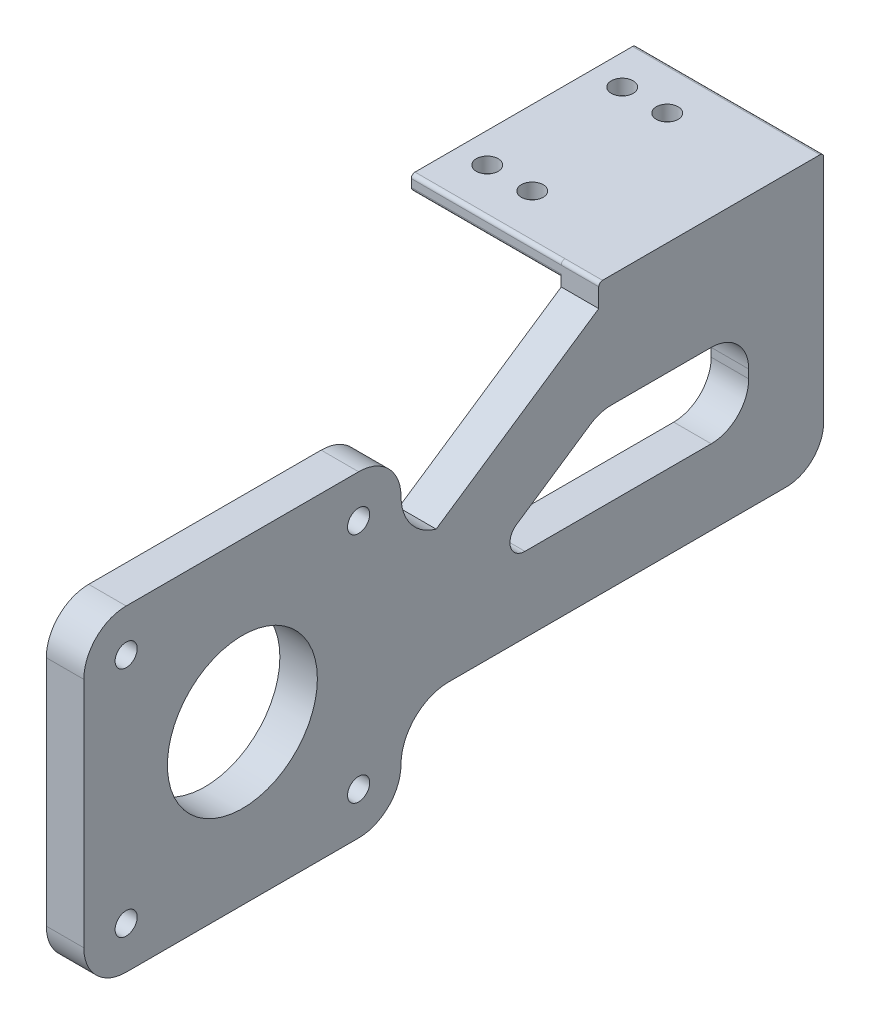
from build123d import *

# Parameters (mm, degrees)
SKETCH_1_R          = 10
SKETCH_1_R_2        = 1.475
EXTRUDE_1_DEPTH     = 5
FILLET_1_R          = 5
FILLET_2_R          = 5
FILLET_3_R          = 5
FILLET_4_R          = 5
FILLET_5_R          = 2
SKETCH_4_W          = 30
SKETCH_4_H          = 2.02
EXTRUDE_2_DEPTH     = 20
FILLET_11_R         = 0.5
FILLET_12_R         = 0.5
RIB_5_REACH         = 106.233
SKETCH_5_WALL_W     = 231.251388166
SKETCH_5_WALL_H     = 30
SKETCH_12_W         = 11
SKETCH_12_H         = 10.392304845
CUT_EXTRUDE_1_DEPTH = 20
FILLET_14_R         = 0.5
FILLET_15_R         = 0.5
SKETCH_14_R         = 1.46
CUT_EXTRUDE_2_DEPTH = 44


with BuildPart() as part:
    # 草图1 → 凸台-拉伸1 (new body)
    with BuildSketch(Plane(origin=(0, 0, 0), x_dir=(0, 0, -1), z_dir=(1, 0, 0))):
        with BuildLine():
            ThreePointArc((77.019141235, 27), (77.372694625, 26.853553391), (77.519141235, 26.5))
            Line((77.519141235, 26.5), (77.519141235, -9.130858765))
            Line((77.519141235, -9.130858765), (47.519141235, -9.130858765))
            Line((47.519141235, -9.130858765), (27.519141235, -9.130858765))
            ThreePointArc((27.519141235, -9.130858765), (23.015478277, -10.996337043), (21.15, -15.5))
            ThreePointArc((21.15, -15.5), (19.495153314, -19.495153314), (15.5, -21.15))
            Line((15.5, -21.15), (-15.5, -21.15))
            ThreePointArc((-15.5, -21.15), (-19.495153314, -19.495153314), (-21.15, -15.5))
            Line((-21.15, -15.5), (-21.15, 15.5))
            ThreePointArc((-21.15, 15.5), (-19.495153314, 19.495153314), (-15.5, 21.15))
            Line((-15.5, 21.15), (15.5, 21.15))
            ThreePointArc((15.5, 21.15), (19.495153314, 19.495153314), (21.15, 15.5))
            ThreePointArc((21.15, 15.5), (22.456034545, 11.635946336), (25.838516133, 9.356592205))
            Line((25.838516133, 9.356592205), (47.519141235, 23.98))
            Line((47.519141235, 23.98), (47.519141235, 26.5))
            ThreePointArc((47.519141235, 26.5), (47.665587844, 26.853553391), (48.019141235, 27))
            Line((48.019141235, 27), (77.019141235, 27))
        make_face()
        Circle(SKETCH_1_R, mode=Mode.SUBTRACT)
        with Locations((-15.5, -15.5)):
            Circle(SKETCH_1_R_2, mode=Mode.SUBTRACT)
        with Locations((15.5, -15.5)):
            Circle(SKETCH_1_R_2, mode=Mode.SUBTRACT)
        with Locations((15.5, 15.5)):
            Circle(SKETCH_1_R_2, mode=Mode.SUBTRACT)
        with Locations((-15.5, 15.5)):
            Circle(SKETCH_1_R_2, mode=Mode.SUBTRACT)
        Polygon((53.519141235, 0.869141235), (31.13826194, 0.869141235), (47.640843236, 12), (67.519141235, 12), (67.519141235, 0.869141235), (59.519141235, 0.869141235), align=None, mode=Mode.SUBTRACT)
    extrude(amount=EXTRUDE_1_DEPTH)

    # 圆角1
    fillet_1_edges = [part.edges().sort_by_distance(p)[0] for p in [
        (2.5, -9.130858765, -77.519141235),
    ]]
    fillet(fillet_1_edges, radius=FILLET_1_R)

    # 圆角2
    fillet_2_edges = [part.edges().sort_by_distance(p)[0] for p in [
        (2.5, 12, -67.519141235),
    ]]
    fillet(fillet_2_edges, radius=FILLET_2_R)

    # 圆角3
    fillet_3_edges = [part.edges().sort_by_distance(p)[0] for p in [
        (2.5, 12, -47.640843236),
    ]]
    fillet(fillet_3_edges, radius=FILLET_3_R)

    # 圆角4
    fillet_4_edges = [part.edges().sort_by_distance(p)[0] for p in [
        (2.5, 0.869141235, -67.519141235),
    ]]
    fillet(fillet_4_edges, radius=FILLET_4_R)

    # 圆角5
    fillet_5_edges = [part.edges().sort_by_distance(p)[0] for p in [
        (2.5, 0.869141235, -31.13826194),
    ]]
    fillet(fillet_5_edges, radius=FILLET_5_R)

    # 草图4 → 凸台-拉伸2 (add)
    with BuildSketch(Plane(origin=(0, 0, 0), x_dir=(0, 0, -1), z_dir=(1, 0, 0))):
        with Locations((62.519141235, 25.99)):
            Rectangle(SKETCH_4_W, SKETCH_4_H)
    extrude(amount=-EXTRUDE_2_DEPTH)

    # 圆角11
    fillet_11_edges = [part.edges().sort_by_distance(p)[0] for p in [
        (-10, 27, -47.519141235),
    ]]
    fillet(fillet_11_edges, radius=FILLET_11_R)

    # 圆角12
    fillet_12_edges = [part.edges().sort_by_distance(p)[0] for p in [
        (-10, 27, -77.519141235),
    ]]
    fillet(fillet_12_edges, radius=FILLET_12_R)

    # 草图5 wall → 筋5 (add, up to next)
    with BuildSketch(Plane(origin=(-9, 19.783847578, -77.519141235), x_dir=(-0.866025403793, 0.499999999985, 0), z_dir=(-0.499999999985, -0.866025403793, 0)), mode=Mode.PRIVATE) as rib_5_sk1:
        with Locations((0, -15)):
            Rectangle(SKETCH_5_WALL_W, SKETCH_5_WALL_H)
    rib_5_tool1 = extrude(rib_5_sk1.sketch, amount=-RIB_5_REACH, mode=Mode.PRIVATE) - part.part
    add(rib_5_tool1.solids().sort_by_distance((-9, 19.783847578, -77.519141235))[0])

    # 草图12 → 切除-拉伸1 (cut)
    with BuildSketch(Plane.ZY.offset(20)):
        with Locations((-72.019141235, 19.783847578)):
            Rectangle(SKETCH_12_W, SKETCH_12_H)
        with Locations((-53.019141235, 19.783847578)):
            Rectangle(SKETCH_12_W, SKETCH_12_H)
    extrude(amount=-CUT_EXTRUDE_1_DEPTH, mode=Mode.SUBTRACT)

    # 圆角14
    fillet_14_edges = [part.edges().sort_by_distance(p)[0] for p in [
        (-10, 24.98, -77.519141235),
    ]]
    fillet(fillet_14_edges, radius=FILLET_14_R)

    # 圆角15
    fillet_15_edges = [part.edges().sort_by_distance(p)[0] for p in [
        (-10, 24.98, -47.519141235),
    ]]
    fillet(fillet_15_edges, radius=FILLET_15_R)

    # 草图14 → 切除-拉伸2 (cut)
    with BuildSketch(Plane(origin=(0, 0, 0), x_dir=(1, 0, 0), z_dir=(0, 1, 0))):
        with Locations(Location((-10, 71.650840547, 0), (0, 0, 90))):
            Circle(SKETCH_14_R)
        with Locations(Location((-16, 71.650840547, 0), (0, 0, 90))):
            Circle(SKETCH_14_R)
        with Locations(Location((-10, 53.650840547, 0), (0, 0, 90))):
            Circle(SKETCH_14_R)
        with Locations(Location((-16, 53.650840547, 0), (0, 0, 90))):
            Circle(SKETCH_14_R)
    extrude(amount=CUT_EXTRUDE_2_DEPTH, mode=Mode.SUBTRACT)


solid = part.part
